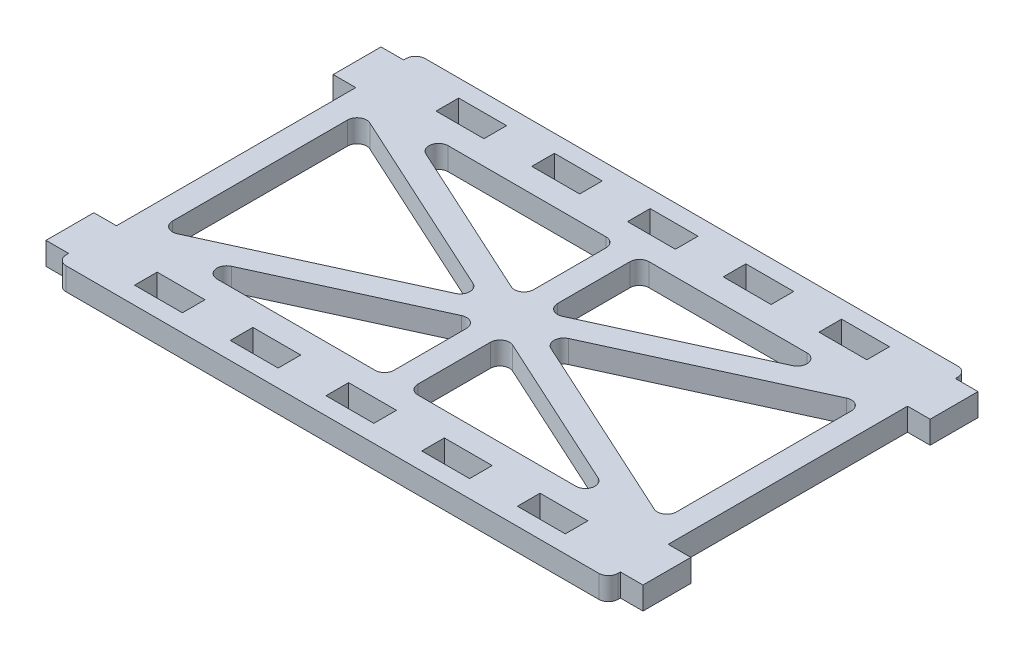
from build123d import *

# Parameters (mm, degrees)
SKETCH1_W           = 146.4
SKETCH1_H           = 95.25
BOSS_EXTRUDE1_DEPTH = 3
SKETCH2_W           = 6
SKETCH2_H           = 12.7
BOSS_EXTRUDE2_DEPTH = 6
SKETCH3_W           = 12.7
SKETCH3_H           = 6
CUT_EXTRUDE1_DEPTH  = 93.610909859
LPATTERN3_COUNT     = 3
LPATTERN3_PITCH     = 25.4
LPATTERN3_COL_COUNT = 3
LPATTERN3_COL_PITCH = 25.4
CUT_EXTRUDE2_DEPTH  = 93.610909859
FILLET1_R           = 2.54


with BuildPart() as part:
    # Sketch1 → Boss-Extrude1 (new, symmetric)
    with BuildSketch(Plane(origin=(0, 0, 0), x_dir=(1, 0, 0), z_dir=(0, 1, 0))):
        Rectangle(SKETCH1_W, SKETCH1_H)
    extrude(amount=BOSS_EXTRUDE1_DEPTH, both=True)

    # Sketch2 → Boss-Extrude2 (add)
    with BuildSketch(Plane(origin=(0, 3, 0), x_dir=(1, 0, 0), z_dir=(0, 1, 0))):
        with Locations((-76.2, 38.1)):
            Rectangle(SKETCH2_W, SKETCH2_H)
        with Locations((-76.2, -38.1)):
            Rectangle(SKETCH2_W, SKETCH2_H)
    boss_extrude2 = extrude(amount=-BOSS_EXTRUDE2_DEPTH)

    # Mirror1: Boss-Extrude2 across plane
    add(boss_extrude2.mirror(Plane(origin=(0, 0, 0), x_dir=(0, 0, 1), z_dir=(1, 0, 0))))

    # Sketch3 → Cut-Extrude1 (cut, symmetric)
    with BuildSketch(Plane(origin=(0, 3, 0), x_dir=(1, 0, 0), z_dir=(0, 1, 0))):
        with Locations((0, -40.005)):
            Rectangle(SKETCH3_W, SKETCH3_H)
        with Locations((0, 40.005)):
            Rectangle(SKETCH3_W, SKETCH3_H)
    cut_extrude1 = extrude(amount=CUT_EXTRUDE1_DEPTH, both=True, mode=Mode.SUBTRACT)

    # LPattern3: Cut-Extrude1 ×3
    with Locations(*[(i * LPATTERN3_PITCH, 0, 0) for i in range(1, LPATTERN3_COUNT)]):
        add(cut_extrude1, mode=Mode.SUBTRACT)

    # LPattern3 col: Cut-Extrude1 ×3
    with Locations(*[(-i * LPATTERN3_COL_PITCH, 0, 0) for i in range(1, LPATTERN3_COL_COUNT)]):
        add(cut_extrude1, mode=Mode.SUBTRACT)

    # Sketch4 → Cut-Extrude2 (cut, through all)
    with BuildSketch(Plane(origin=(0, 3, 0), x_dir=(1, 0, 0), z_dir=(0, 1, 0))):
        Polygon((-3.175, 30.655), (-59.232948188, 30.655), (-3.175, 4.948845898), align=None)
        Polygon((-7.617051812, 0), (-66.85, 27.16209464), (-66.85, -27.16209464), align=None)
        Polygon((-3.175, -4.948845898), (-59.232948188, -30.655), (-3.175, -30.655), align=None)
        Polygon((59.232948188, -30.655), (3.175, -4.948845898), (3.175, -30.655), align=None)
        Polygon((66.85, 27.16209464), (7.617051812, 0), (66.85, -27.16209464), align=None)
        Polygon((59.232948188, 30.655), (3.175, 30.655), (3.175, 4.948845898), align=None)
    extrude(amount=-CUT_EXTRUDE2_DEPTH, mode=Mode.SUBTRACT)

    # Fillet1
    fillet1_edges = [part.edges().sort_by_distance(p)[0] for p in [
        (-3.175, 0, 4.948845898),
        (-3.175, 0, 30.655),
        (-59.232948188, 0, 30.655),
        (-7.617051812, 0, 0),
        (-66.85, 0, 27.16209464),
        (-66.85, 0, -27.16209464),
        (66.85, 0, -27.16209464),
        (66.85, 0, 27.16209464),
        (7.617051812, 0, 0),
        (3.175, 0, 4.948845898),
        (59.232948188, 0, 30.655),
        (3.175, 0, 30.655),
        (3.175, 0, -30.655),
        (59.232948188, 0, -30.655),
        (3.175, 0, -4.948845898),
        (-59.232948188, 0, -30.655),
        (-3.175, 0, -30.655),
        (-3.175, 0, -4.948845898),
        (-73.2, 0, -47.625),
        (73.2, 0, -47.625),
        (73.2, 0, 47.625),
        (-73.2, 0, 47.625),
    ]]
    fillet(fillet1_edges, radius=FILLET1_R)


solid = part.part
